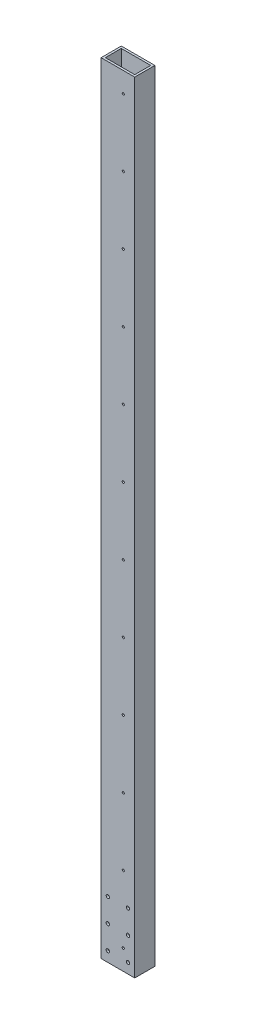
from build123d import *

# Parameters (mm, degrees)
SKETCH1_W                       = 63.5
SKETCH1_H                       = 38.1
SKETCH1_W_2                     = 55.5752
SKETCH1_H_2                     = 30.1752
EXTRUDE_THIN1_DEPTH             = 1473.2
F_10_32_TAPPED_HOLE1_D          = 4.0386
F_10_32_TAPPED_HOLE1_DEPTH      = 20.1676
F_10_32_TAPPED_HOLE1_TIP        = 1.213317848
F_1_4_0_25_DIAMETER_HOLE1_D     = 6.35
F_1_4_0_25_DIAMETER_HOLE1_DEPTH = 101.6
F_1_4_0_25_DIAMETER_HOLE1_TIP   = 1.907732465


with BuildPart() as part:
    # Sketch1 → Extrude-Thin1 (new body)
    with BuildSketch(Plane(origin=(0, 0, 0), x_dir=(1, 0, 0), z_dir=(0, 1, 0))):
        with Locations((-46.224264706, 13.478186275)):
            Rectangle(SKETCH1_W, SKETCH1_H)
        with Locations((-46.224264706, 13.478186275)):
            Rectangle(SKETCH1_W_2, SKETCH1_H_2, mode=Mode.SUBTRACT)
    extrude(amount=EXTRUDE_THIN1_DEPTH)

    # #10-32 Tapped Hole1
    with Locations(Plane.XY.offset(5.571813725)):
        with Locations((-36.064264706, 38.1), (-36.064264706, 165.1), (-36.064264706, 292.1), (-36.064264706, 419.1), (-36.064264706, 546.1), (-36.064264706, 673.1), (-36.064264706, 800.1), (-36.064264706, 927.1), (-36.064264706, 1054.1), (-36.064264706, 1181.1), (-36.064264706, 1308.1), (-36.064264706, 1435.1)):
            Hole(F_10_32_TAPPED_HOLE1_D / 2, depth=F_10_32_TAPPED_HOLE1_DEPTH)
            with Locations((0, 0, -(F_10_32_TAPPED_HOLE1_DEPTH + F_10_32_TAPPED_HOLE1_TIP / 2))):  # 118° drill point
                Cone(0, F_10_32_TAPPED_HOLE1_D / 2, F_10_32_TAPPED_HOLE1_TIP, mode=Mode.SUBTRACT)

    # 1/4 (0.25) Diameter Hole1
    with Locations(Plane(origin=(-297.260574761, -585.300074831, -36.084186228), x_dir=(-1.0, -1.0349876365418451e-08, 1.6519024547516887e-10), z_dir=(-1.651902454751689e-10, 0, -1.0))):
        with Locations((-270.086317003, 693.250072448), (-231.986317003, 693.250072747), (-270.086316654, 648.800072448), (-231.986316654, 648.800072747), (-270.086316305, 604.350072448), (-231.986316305, 604.350072747)):
            Hole(F_1_4_0_25_DIAMETER_HOLE1_D / 2, depth=F_1_4_0_25_DIAMETER_HOLE1_DEPTH)
            with Locations((0, 0, -(F_1_4_0_25_DIAMETER_HOLE1_DEPTH + F_1_4_0_25_DIAMETER_HOLE1_TIP / 2))):  # 118° drill point
                Cone(0, F_1_4_0_25_DIAMETER_HOLE1_D / 2, F_1_4_0_25_DIAMETER_HOLE1_TIP, mode=Mode.SUBTRACT)


solid = part.part
